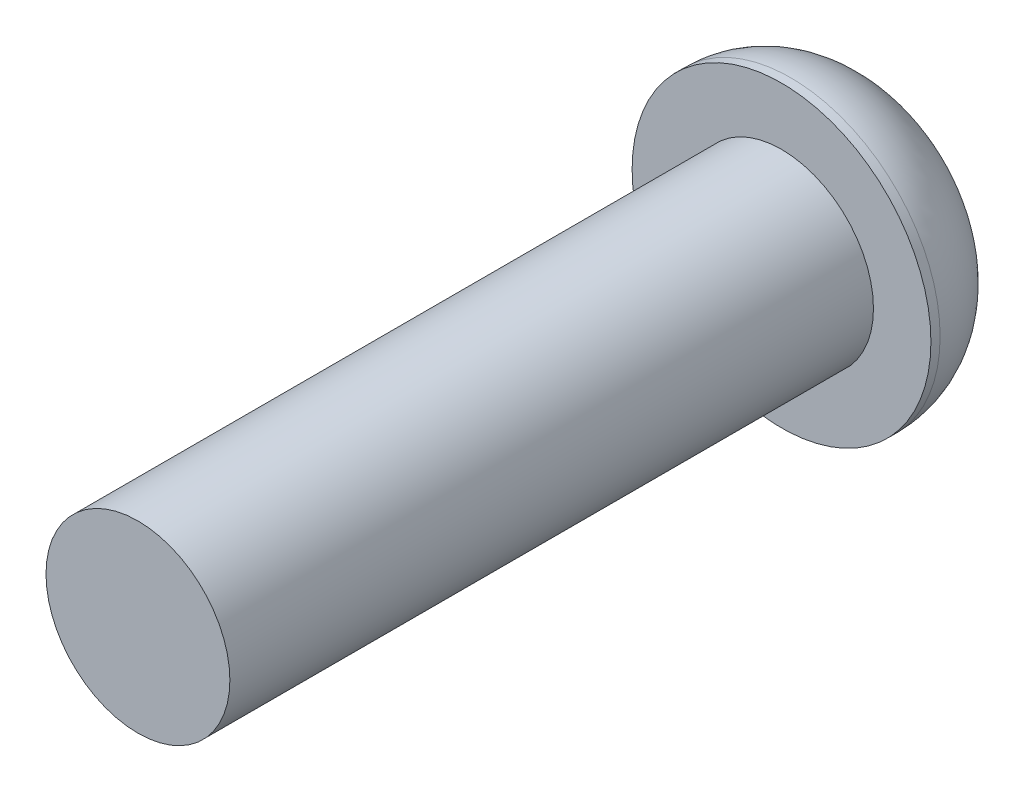
from build123d import *

# Parameters (mm, degrees)
SKETCH_1_R          = 2
EXTRUDE_1_DEPTH     = 14
SKETCH_2_R          = 3.25
EXTRUDE_2_DEPTH     = 2.2
FILLET_1_R          = 2
CUT_EXTRUDE_1_DEPTH = 0.5


with BuildPart() as part:
    # 草图1 → 凸台-拉伸1 (new body)
    with BuildSketch(Plane.XY):
        Circle(SKETCH_1_R)
    extrude(amount=EXTRUDE_1_DEPTH)

    # 草图2 → 凸台-拉伸2 (add)
    with BuildSketch(Plane(origin=(0, 0, 0), x_dir=(-1, 0, 0), z_dir=(0, 0, -1))):
        Circle(SKETCH_2_R)
    extrude(amount=EXTRUDE_2_DEPTH)

    # 圆角1
    fillet_1_edges = [part.edges().sort_by_distance(p)[0] for p in [
        (3.25, 0, -2.2),
    ]]
    fillet(fillet_1_edges, radius=FILLET_1_R)

    # 草图3 → 切除-拉伸1 (cut)
    with BuildSketch(Plane(origin=(0, 0, -2.2), x_dir=(-1, 0, 0), z_dir=(0, 0, -1))):
        Polygon((3.239974874, 0.25), (3.239974874, -0.25), (0.25, -0.25), (0.25, -3.239974874), (-0.25, -3.239974874), (-0.25, -0.25), (-3.239974874, -0.25), (-3.239974874, 0.25), (-0.25, 0.25), (-0.25, 3.239974874), (0.25, 3.239974874), (0.25, 0.25), align=None)
    extrude(amount=-CUT_EXTRUDE_1_DEPTH, mode=Mode.SUBTRACT)


solid = part.part
